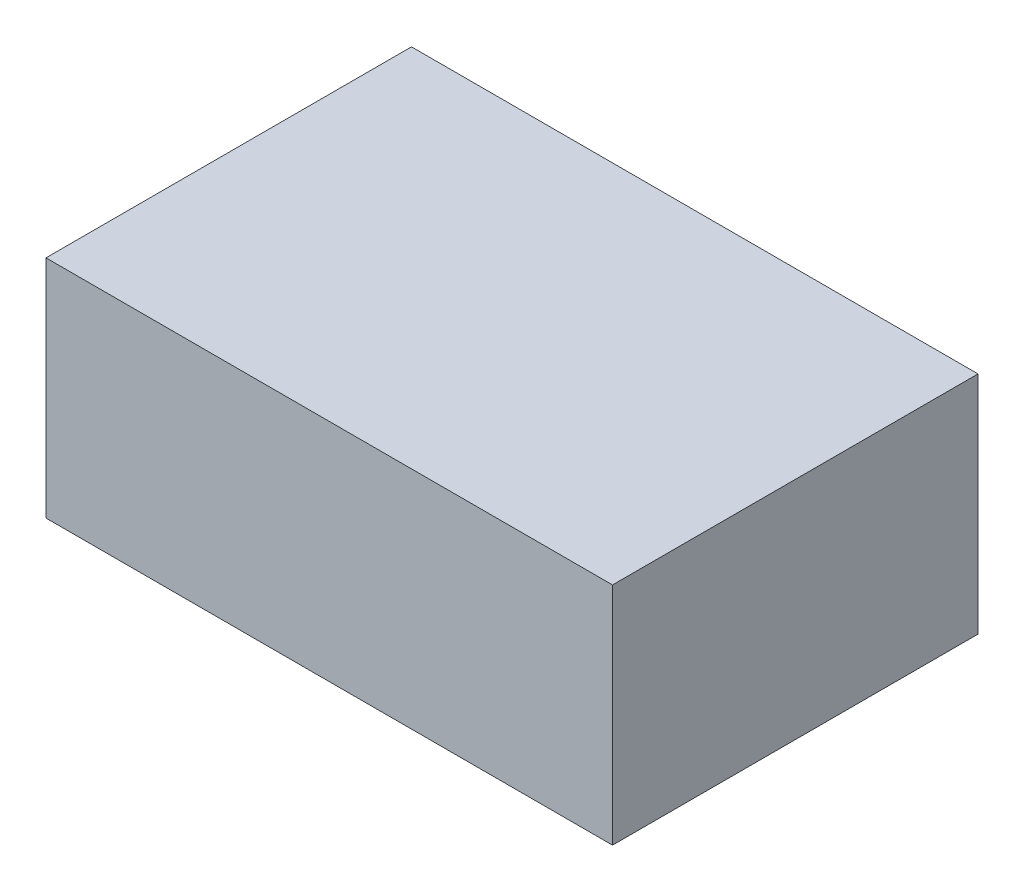
from build123d import *

# Parameters (mm, degrees)
SKETCH1_W           = 295.275
SKETCH1_H           = 190.5
BOSS_EXTRUDE1_DEPTH = 117.475


with BuildPart() as part:
    # Sketch1 → Boss-Extrude1 (new body)
    with BuildSketch(Plane(origin=(0, 0, 0), x_dir=(1, 0, 0), z_dir=(0, 1, 0))):
        Rectangle(SKETCH1_W, SKETCH1_H)
    extrude(amount=BOSS_EXTRUDE1_DEPTH)


solid = part.part
